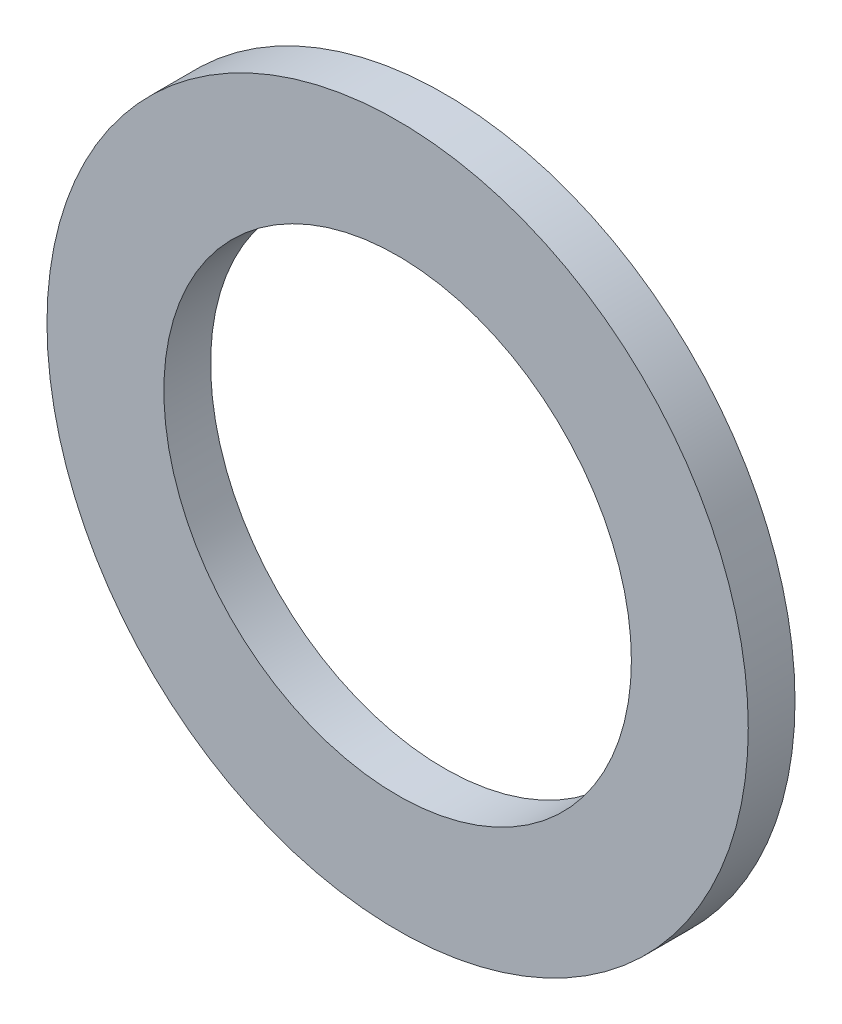
from build123d import *

# Parameters (mm, degrees)
ESQUISSE1_R          = 15
ESQUISSE1_R_2        = 10
BASE_EXTRUSION_DEPTH = 2


with BuildPart() as part:
    # Esquisse1 → Base-Extrusion (new body)
    with BuildSketch(Plane.XY):
        Circle(ESQUISSE1_R)
        Circle(ESQUISSE1_R_2, mode=Mode.SUBTRACT)
    extrude(amount=BASE_EXTRUSION_DEPTH)


solid = part.part
